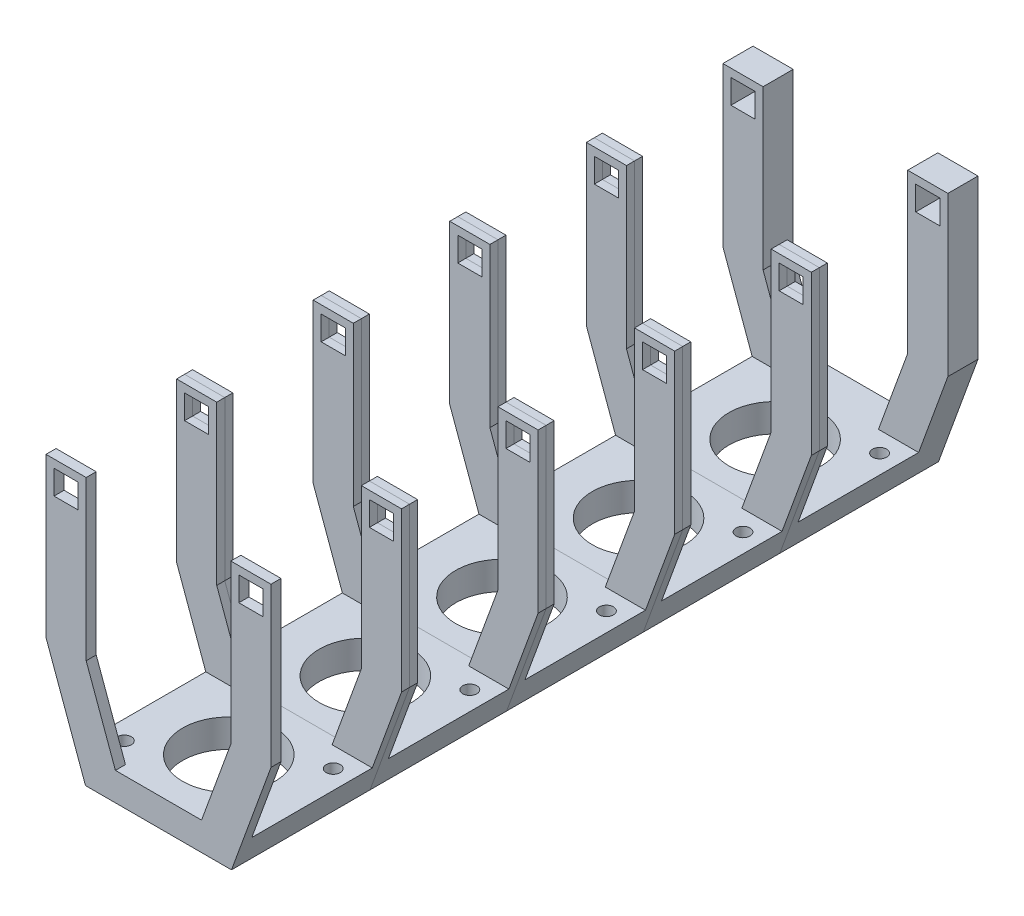
from build123d import *

# Parameters (mm, degrees)
SKETCH3_W           = 6
SKETCH3_H           = 6
BOSS_EXTRUDE1_DEPTH = 2
BOSS_EXTRUDE2_DEPTH = 30
SKETCH4_W           = 6
SKETCH4_H           = 6
BOSS_EXTRUDE6_DEPTH = 2
LPATTERN7_COUNT     = 5
LPATTERN7_PITCH     = 34
SKETCH12_W          = 6
SKETCH12_H          = 6
BOSS_EXTRUDE7_DEPTH = 2
BOSS_EXTRUDE8_DEPTH = 0.5
SKETCH15_R          = 11.5
SKETCH15_R_2        = 1.75
CUT_EXTRUDE5_DEPTH  = 7
LPATTERN8_COUNT     = 5
LPATTERN8_PITCH     = 34
SKETCH17_W          = 6
SKETCH17_H          = 6
CUT_EXTRUDE6_DEPTH  = 5.5
SKETCH18_W          = 6
SKETCH18_H          = 6
BOSS_EXTRUDE9_DEPTH = 3.5


with BuildPart() as part:
    # Sketch3 → Boss-Extrude1 (new body)
    with BuildSketch(Plane.XY):
        Polygon((12.279404685, -25), (5, -5), (5, 34.5), (-5, 34.5), (-5, -5), (4.827196325, -32), (41.172803675, -32), (51, -5), (51, 34.5), (41, 34.5), (41, -5), (33.720595315, -25), align=None)
        with Locations((0, 29.5)):
            Rectangle(SKETCH3_W, SKETCH3_H, mode=Mode.SUBTRACT)
        with Locations((46, 29.5)):
            Rectangle(SKETCH3_W, SKETCH3_H, mode=Mode.SUBTRACT)
    extrude(amount=BOSS_EXTRUDE1_DEPTH)

    # Sketch3<4> → Boss-Extrude2 (add)
    with BuildSketch(Plane.XY):
        Polygon((33.720595315, -25), (12.279404685, -25), (2.279404685, -25), (4.827196325, -32), (41.172803675, -32), (43.720595315, -25), align=None)
    extrude(amount=-BOSS_EXTRUDE2_DEPTH)

    # Sketch4 → Boss-Extrude6 (add)
    with BuildSketch(Plane(origin=(0, 0, -30), x_dir=(-1, 0, 0), z_dir=(0, 0, -1))):
        Polygon((5, -5), (5, 34.5), (-5, 34.5), (-5, -5), (-12.279404685, -25), (-33.720595315, -25), (-41, -5), (-41, 34.5), (-51, 34.5), (-51, -5), (-43.720595315, -25), (-41.172803675, -32), (-4.827196325, -32), (-2.279404685, -25), align=None)
        with Locations((0, 29.5)):
            Rectangle(SKETCH4_W, SKETCH4_H, mode=Mode.SUBTRACT)
        with Locations((-46, 29.5)):
            Rectangle(SKETCH4_W, SKETCH4_H, mode=Mode.SUBTRACT)
    extrude(amount=BOSS_EXTRUDE6_DEPTH)


with BuildPart() as lpattern7_1:
    # LPattern7: pattern copy
    add(part.part.moved(Location(Vector(0, 0, 1) * (1 * LPATTERN7_PITCH))))


with BuildPart() as lpattern7_2:
    # LPattern7: pattern copy
    add(part.part.moved(Location(Vector(0, 0, 1) * (2 * LPATTERN7_PITCH))))


with BuildPart() as lpattern7_3:
    # LPattern7: pattern copy
    add(part.part.moved(Location(Vector(0, 0, 1) * (3 * LPATTERN7_PITCH))))


with BuildPart() as lpattern7_4:
    # LPattern7: pattern copy
    add(part.part.moved(Location(Vector(0, 0, 1) * (4 * LPATTERN7_PITCH))))

    # Sketch13 → Boss-Extrude8 (add)
    with BuildSketch(Plane.XY.offset(138)):
        Polygon((41, -5), (41, 34.5), (51, 34.5), (51, -5), (41.172803675, -32), (4.827196325, -32), (-5, -5), (-5, 34.5), (5, 34.5), (5, -5), (12.279404685, -25), (33.720595315, -25), align=None)
    extrude(amount=BOSS_EXTRUDE8_DEPTH)

    # Sketch15 → Cut-Extrude5 (cut)
    with BuildSketch(Plane(origin=(0, -25, 0), x_dir=(1, 0, 0), z_dir=(0, 1, 0))):
        with Locations(Location((23, -121, 0), (0, 0, 270))):
            Circle(SKETCH15_R)
        with Locations(Location((7, -131, 0), (0, 0, 270))):
            Circle(SKETCH15_R_2)
        with Locations(Location((39, -111, 0), (0, 0, 270))):
            Circle(SKETCH15_R_2)
    cut_extrude5 = extrude(amount=-CUT_EXTRUDE5_DEPTH, mode=Mode.SUBTRACT)

    # Sketch17 → Cut-Extrude6 (cut)
    with BuildSketch(Plane.XY.offset(138.5)):
        with Locations((0, 29.5)):
            Rectangle(SKETCH17_W, SKETCH17_H)
        with Locations((46, 29.5)):
            Rectangle(SKETCH17_W, SKETCH17_H)
    extrude(amount=-CUT_EXTRUDE6_DEPTH, mode=Mode.SUBTRACT)


with BuildPart() as part_1:
    add(part.part)

    # Sketch12 → Boss-Extrude7 (add)
    with BuildSketch(Plane(origin=(0, 0, -32), x_dir=(-1, 0, 0), z_dir=(0, 0, -1))):
        Polygon((-5, 34.5), (-5, -5), (-12.279404685, -25), (-33.720595315, -25), (-41, -5), (-41, 34.5), (-51, 34.5), (-51, -5), (-41.172803675, -32), (-4.827196325, -32), (5, -5), (5, 34.5), align=None)
        with Locations((-46, 29.5)):
            Rectangle(SKETCH12_W, SKETCH12_H, mode=Mode.SUBTRACT)
        with Locations((0, 29.5)):
            Rectangle(SKETCH12_W, SKETCH12_H, mode=Mode.SUBTRACT)
    extrude(amount=BOSS_EXTRUDE7_DEPTH)


with BuildPart() as lpattern8_tool:
    # LPattern8: Cut-Extrude5 ×5
    with Locations(*[(0, 0, -i * LPATTERN8_PITCH) for i in range(1, LPATTERN8_COUNT)]):
        add(cut_extrude5)


with BuildPart() as part_2:
    add(part_1.part)

    # LPattern8: cut by lpattern8_tool
    add(lpattern8_tool.part, mode=Mode.SUBTRACT)

    # Sketch18 → Boss-Extrude9 (add)
    with BuildSketch(Plane(origin=(0, 0, -34), x_dir=(-1, 0, 0), z_dir=(0, 0, -1))):
        Polygon((5, -5), (5, 34.5), (-5, 34.5), (-5, -5), (-12.279404685, -25), (-33.720595315, -25), (-41, -5), (-41, 34.5), (-51, 34.5), (-51, -5), (-41.172803675, -32), (-4.827196325, -32), align=None)
        with Locations((0, 29.5)):
            Rectangle(SKETCH18_W, SKETCH18_H, mode=Mode.SUBTRACT)
        with Locations((-46, 29.5)):
            Rectangle(SKETCH18_W, SKETCH18_H, mode=Mode.SUBTRACT)
    extrude(amount=BOSS_EXTRUDE9_DEPTH)


with BuildPart() as lpattern7_1_1:
    add(lpattern7_1.part)

    # LPattern8: cut by lpattern8_tool
    add(lpattern8_tool.part, mode=Mode.SUBTRACT)


with BuildPart() as lpattern7_2_1:
    add(lpattern7_2.part)

    # LPattern8: cut by lpattern8_tool
    add(lpattern8_tool.part, mode=Mode.SUBTRACT)


with BuildPart() as lpattern7_3_1:
    add(lpattern7_3.part)

    # LPattern8: cut by lpattern8_tool
    add(lpattern8_tool.part, mode=Mode.SUBTRACT)


solid = Compound([lpattern7_4.part, part_2.part, lpattern7_1_1.part, lpattern7_2_1.part, lpattern7_3_1.part])
